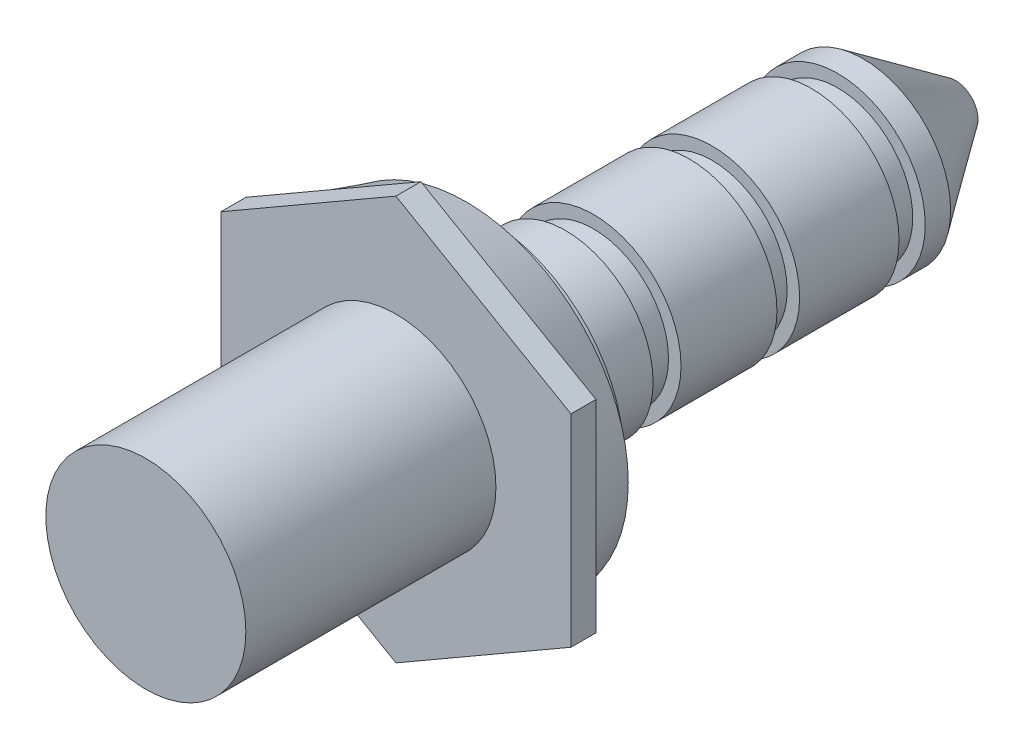
from build123d import *

# Parameters (mm, degrees)
SALIENTE_EXTRUIR1_DEPTH = 1
CROQUIS2_R              = 4
SALIENTE_EXTRUIR2_DEPTH = 10


with BuildPart() as part:
    # Croquis1 → Saliente-Extruir1 (new body)
    with BuildSketch(Plane.XY):
        Polygon((0, -8.082903769), (7, -4.041451884), (7, 4.041451884), (0, 8.082903769), (-7, 4.041451884), (-7, -4.041451884), align=None)
    extrude(amount=SALIENTE_EXTRUIR1_DEPTH)

    # Croquis2 → Saliente-Extruir2 (add)
    with BuildSketch(Plane.XY.offset(1)):
        Circle(CROQUIS2_R)
    extrude(amount=SALIENTE_EXTRUIR2_DEPTH)

    # Croquis3 → Revolución1 (revolve)
    with BuildSketch(Plane(origin=(0, 0, 0), x_dir=(1, 0, 0), z_dir=(0, 1, 0))):
        Polygon((0, 21.382125591), (0.894479356, 21.382125591), (3.5, 17.682529237), (3.5, 16.666829395), (3, 16.666829395), (3, 15.620463348), (3.5, 15.620463348), (3.5, 11.644272372), (3, 11.644272372), (3, 10.737421798), (3.5, 10.737421798), (3.5, 6.900746294), (3, 6.900746294), (3, 5.784622511), (3.5, 5.784622511), (3.5, 2.645524372), (5.467415644, 2.645524372), (5.467415644, 1.808431535), (6.483115486, 1.808431535), (7, 0), (0, 0), align=None)
    revolve(axis=Axis((0, 0, 0), (0, 0, -1)))


solid = part.part
